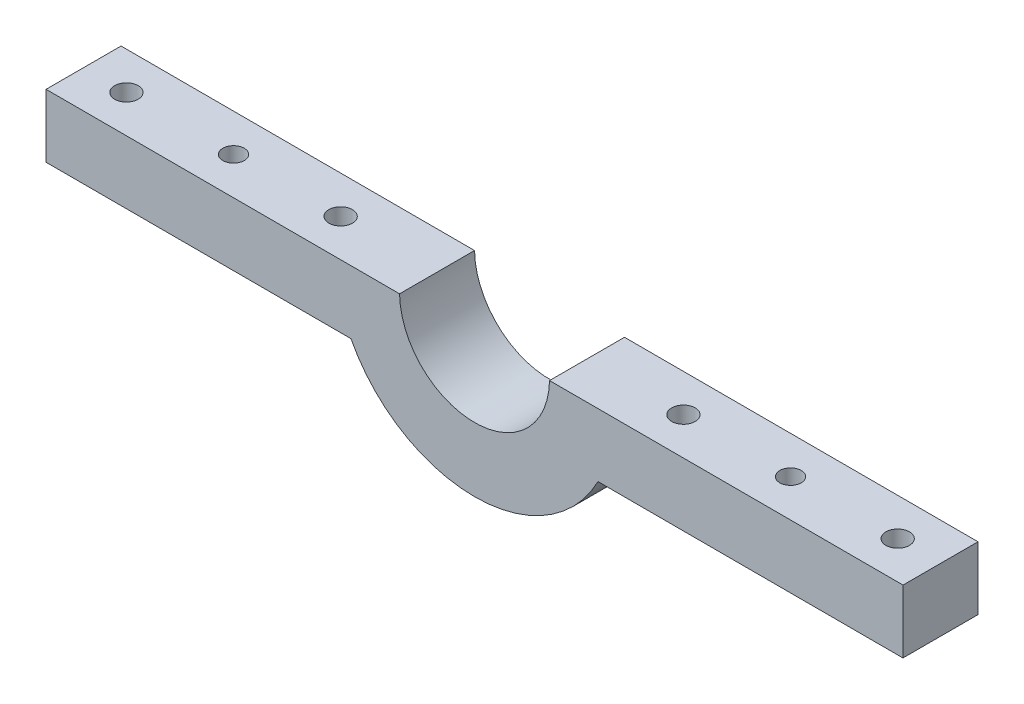
from build123d import *

# Parameters (mm, degrees)
RESSALTO_EXTRUS_O1_DEPTH         = 35
FURO_DE_DI_METRO_11_0_11_1_D     = 11
FUROS_GUIA_COM_10_0MM1_D         = 10
FURO_DE_DI_METRO_11_0_11_2_D     = 11
FURO_DE_DI_METRO_11_0_11_2_DEPTH = 10
FURO_DE_DI_METRO_11_0_11_2_TIP   = 3.304733405


with BuildPart() as part:
    # Esboço1 → Ressalto-extrusão1 (new body)
    with BuildSketch(Plane.XY):
        with BuildLine():
            Line((-199.997669575, -240.109131808), (-34.994179097, -240.27276126))
            ThreePointArc((-34.994179097, -240.27276126), (-0.031980607, -274.807449281), (34.998643265, -240.34217123))
            Line((34.998643265, -240.34217123), (200.002133743, -240.505800682))
            Line((200.002133743, -240.505800682), (199.972879413, -270.005786177))
            Line((199.972879413, -270.005786177), (57.635762375, -269.864634348))
            ThreePointArc((57.635762375, -269.864634348), (-0.061730772, -304.80743453), (-57.689806866, -269.750269132))
            Line((-57.689806866, -269.750269132), (-200.026923904, -269.609117302))
            Line((-200.026923904, -269.609117302), (-199.997669575, -240.109131808))
        make_face()
    extrude(amount=-RESSALTO_EXTRUS_O1_DEPTH)

    # Furo de diâmetro Ø11.0 (11)1 (through all)
    with Locations(Plane(origin=(-0.238306111, -240.30722771, 0), x_dir=(0.9999995082930158, -0.000991672187112085, 0), z_dir=(0.000991672187112085, 0.9999995082930158, 0))):
        with Locations((-179.759461687, 17.5), (-79.759461687, 17.5), (80.240538313, 17.5), (180.240538313, 17.5)):
            Hole(FURO_DE_DI_METRO_11_0_11_1_D / 2)

    # Furos-guia com Ø10.0mm1 (through all)
    with Locations(Plane(origin=(-0.267560441, -269.807213205, 0), x_dir=(-0.9999995082930158, 0.0009916721871120312, 0), z_dir=(-0.0009916721871120312, -0.9999995082930158, 0))):
        with Locations((129.759461687, 17.5), (-130.240538313, 17.5), (-221.181262437, -155.418379851)):
            Hole(FUROS_GUIA_COM_10_0MM1_D / 2)

    # Furo de diâmetro Ø11.0 (11)2
    with Locations(Plane(origin=(-0.267560441, -269.807213205, 0), x_dir=(-0.9999995082930158, 0.0009916721871120312, 0), z_dir=(-0.0009916721871120312, -0.9999995082930158, 0))):
        with Locations((129.759461687, 17.5), (-130.240538313, 17.5)):
            Hole(FURO_DE_DI_METRO_11_0_11_2_D / 2, depth=FURO_DE_DI_METRO_11_0_11_2_DEPTH)
            with Locations((0, 0, -(FURO_DE_DI_METRO_11_0_11_2_DEPTH + FURO_DE_DI_METRO_11_0_11_2_TIP / 2))):  # 118° drill point
                Cone(0, FURO_DE_DI_METRO_11_0_11_2_D / 2, FURO_DE_DI_METRO_11_0_11_2_TIP, mode=Mode.SUBTRACT)


solid = part.part
